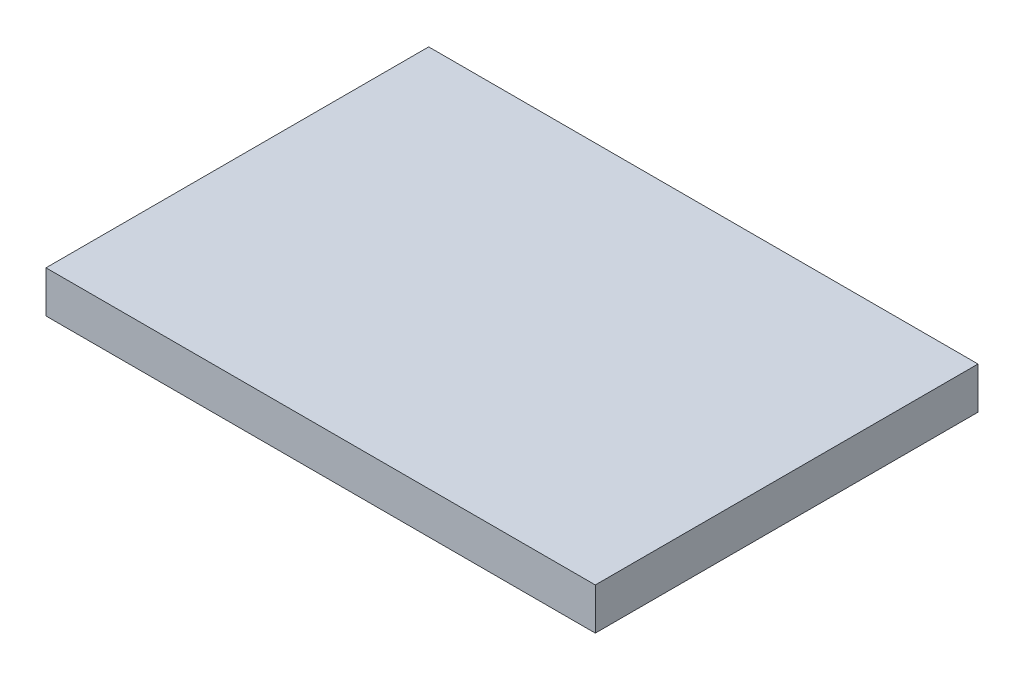
from build123d import *

# Parameters (mm, degrees)
SKETCH1_W           = 78.94657928
SKETCH1_H           = 55
BOSS_EXTRUDE1_DEPTH = 6


with BuildPart() as part:
    # Sketch1 → Boss-Extrude1 (new body)
    with BuildSketch(Plane(origin=(0, 0, 0), x_dir=(1, 0, 0), z_dir=(0, 1, 0))):
        with Locations((-3.02671036, 0)):
            Rectangle(SKETCH1_W, SKETCH1_H)
    extrude(amount=BOSS_EXTRUDE1_DEPTH)


solid = part.part
